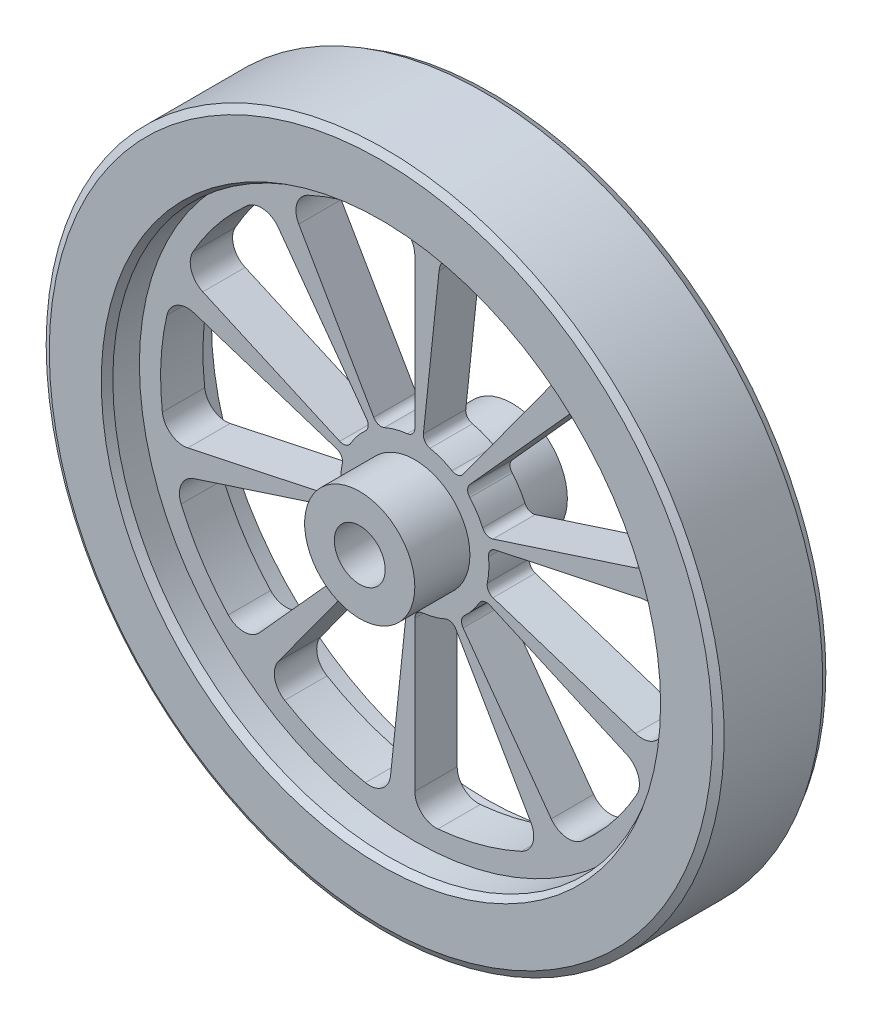
from build123d import *
from OCP.BRepFilletAPI import BRepFilletAPI_MakeChamfer

# Parameters (mm, degrees)
SKETCH1_R           = 80
SKETCH1_R_2         = 6
BOSS_EXTRUDE1_DEPTH = 13
SKETCH2_R           = 65
CUT_EXTRUDE1_DEPTH  = 8
SKETCH3_R           = 13
SKETCH3_R_2         = 6
BOSS_EXTRUDE2_DEPTH = 18
CHAMFER1_SIZE       = 1
CHAMFER1_SIZE2      = 1.732050808
CUT_EXTRUDE2_DEPTH  = 116.451288429
CIRPATTERN1_COUNT   = 10


with BuildPart() as part:
    # Sketch1 → Boss-Extrude1 (new, symmetric)
    with BuildSketch(Plane.XY):
        with Locations(Location((0, 0, 0), (0, 0, 180))):
            Circle(SKETCH1_R)
        with Locations(Location((0, 0, 0), (0, 0, 180))):
            Circle(SKETCH1_R_2, mode=Mode.SUBTRACT)
    extrude(amount=BOSS_EXTRUDE1_DEPTH, both=True)

    # Sketch2 → Cut-Extrude1 (cut)
    with BuildSketch(Plane.XY.offset(13)):
        Circle(SKETCH2_R)
    cut_extrude1 = extrude(amount=-CUT_EXTRUDE1_DEPTH, mode=Mode.SUBTRACT)

    # Mirror1: Cut-Extrude1 across plane
    add(cut_extrude1.mirror(Plane.XY), mode=Mode.SUBTRACT)

    # Sketch3 → Boss-Extrude2 (add, symmetric)
    with BuildSketch(Plane.XY):
        with Locations(Location((0, 0, 0), (0, 0, 180))):
            Circle(SKETCH3_R)
        with Locations(Location((0, 0, 0), (0, 0, 180))):
            Circle(SKETCH3_R_2, mode=Mode.SUBTRACT)
    extrude(amount=BOSS_EXTRUDE2_DEPTH, both=True)

    # Chamfer1: one chamfer whose edges measure the first distance from different faces: ONE call of the kernel's chamfer builder (chamfer() names one face for all edges)
    chamfer1_edges_1 = [part.edges().sort_by_distance(p)[0] for p in [
        (-65, 0, 13),
    ]]
    chamfer1_side_1 = [part.faces().sort_by_distance(p)[0] for p in [
        (77.7372583, 0, 13),
    ]]
    chamfer1_edges_2 = [part.edges().sort_by_distance(p)[0] for p in [
        (-65, 0, -13),
    ]]
    chamfer1_side_2 = [part.faces().sort_by_distance(p)[0] for p in [
        (-65, 0, -9),
    ]]
    chamfer1_edges_3 = [part.edges().sort_by_distance(p)[0] for p in [
        (80, 0, -13),
    ]]
    chamfer1_side_3 = [part.faces().sort_by_distance(p)[0] for p in [
        (77.7372583, 0, -13),
    ]]
    chamfer1_edges_4 = [part.edges().sort_by_distance(p)[0] for p in [
        (80, 0, 13),
    ]]
    chamfer1_side_4 = [part.faces().sort_by_distance(p)[0] for p in [
        (80, 0, 0),
    ]]
    chamfer1 = BRepFilletAPI_MakeChamfer(part.part.solid().wrapped)
    for e in chamfer1_edges_1:
        chamfer1.Add(CHAMFER1_SIZE, CHAMFER1_SIZE2, e.wrapped, chamfer1_side_1[0].wrapped)  # the first distance lies on this face
    for e in chamfer1_edges_2:
        chamfer1.Add(CHAMFER1_SIZE, CHAMFER1_SIZE2, e.wrapped, chamfer1_side_2[0].wrapped)  # the first distance lies on this face
    for e in chamfer1_edges_3:
        chamfer1.Add(CHAMFER1_SIZE, CHAMFER1_SIZE2, e.wrapped, chamfer1_side_3[0].wrapped)  # the first distance lies on this face
    for e in chamfer1_edges_4:
        chamfer1.Add(CHAMFER1_SIZE, CHAMFER1_SIZE2, e.wrapped, chamfer1_side_4[0].wrapped)  # the first distance lies on this face
    add(Compound.cast(chamfer1.Shape()), mode=Mode.REPLACE)

    # Sketch4 → Cut-Extrude2 (cut, through all)
    with BuildSketch(Plane.XY.offset(5)):
        with BuildLine():
            Line((0, 54.772255751), (0, 19.397164741))
            ThreePointArc((0, 19.397164741), (-0.515032591, 18.057436487), (-1.794871795, 17.407711947))
            ThreePointArc((-1.794871795, 17.407711947), (-4.529333289, 16.90370196), (-7.149451403, 15.972956666))
            ThreePointArc((-7.149451403, 15.972956666), (-8.582686936, 15.895715021), (-9.698582371, 16.798437427))
            Line((-9.698582371, 16.798437427), (-27.386127875, 47.434164903))
            ThreePointArc((-27.386127875, 47.434164903), (-27.821744262, 51.446675992), (-25.152000934, 54.473634439))
            ThreePointArc((-25.152000934, 54.473634439), (-15.529142706, 57.955549577), (-5.454545455, 59.751551728))
            ThreePointArc((-5.454545455, 59.751551728), (-1.629000688, 58.46500048), (0, 54.772255751))
        make_face()
    cut_extrude2 = extrude(amount=-CUT_EXTRUDE2_DEPTH, mode=Mode.SUBTRACT)

    # CirPattern1: Cut-Extrude2 ×10 about axis
    cirpattern1_axis = Axis((0, 0, 0), (0, 0, 1))
    for i in range(1, CIRPATTERN1_COUNT):
        add(cut_extrude2.rotate(cirpattern1_axis, i * 360 / CIRPATTERN1_COUNT), mode=Mode.SUBTRACT)


solid = part.part
